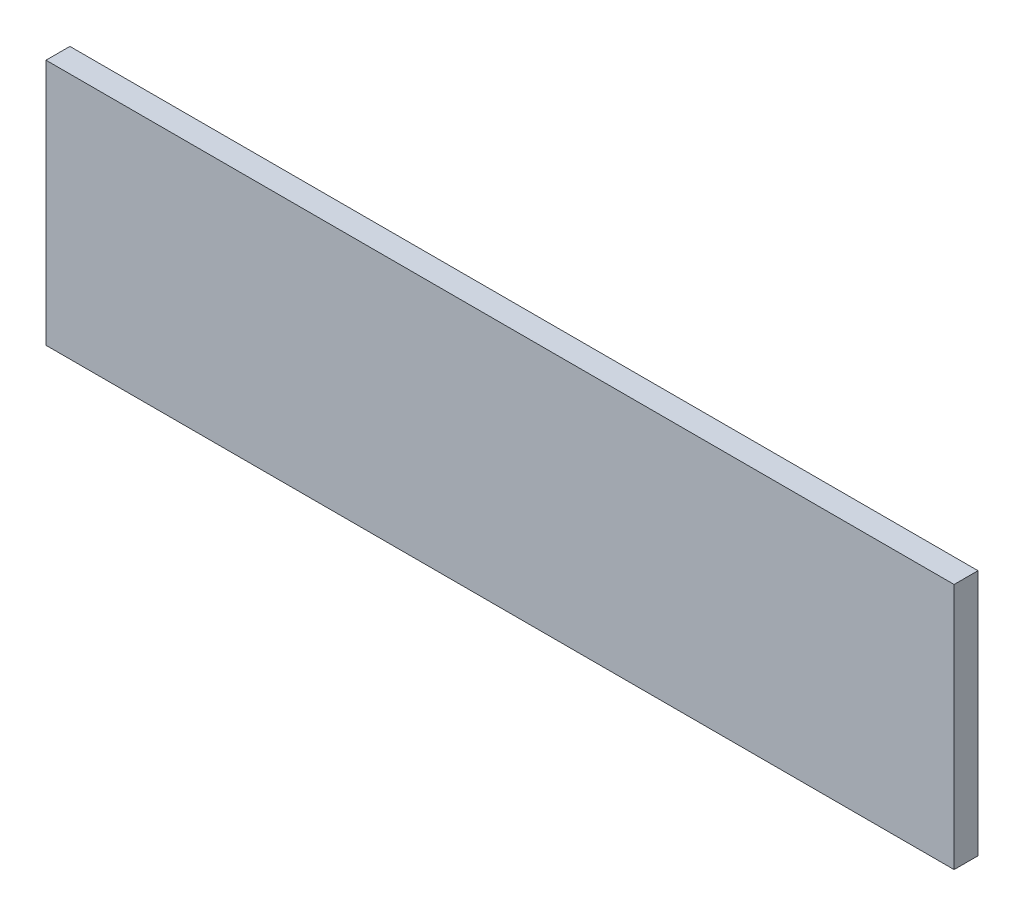
from build123d import *

# Parameters (mm, degrees)
SKETCH_1_W      = 114
SKETCH_1_H      = 3
EXTRUDE_1_DEPTH = 31


with BuildPart() as part:
    # 草图1 → 凸台-拉伸1 (new body)
    with BuildSketch(Plane(origin=(0, 0, 0), x_dir=(1, 0, 0), z_dir=(0, 1, 0))):
        Rectangle(SKETCH_1_W, SKETCH_1_H)
    extrude(amount=EXTRUDE_1_DEPTH)


solid = part.part
